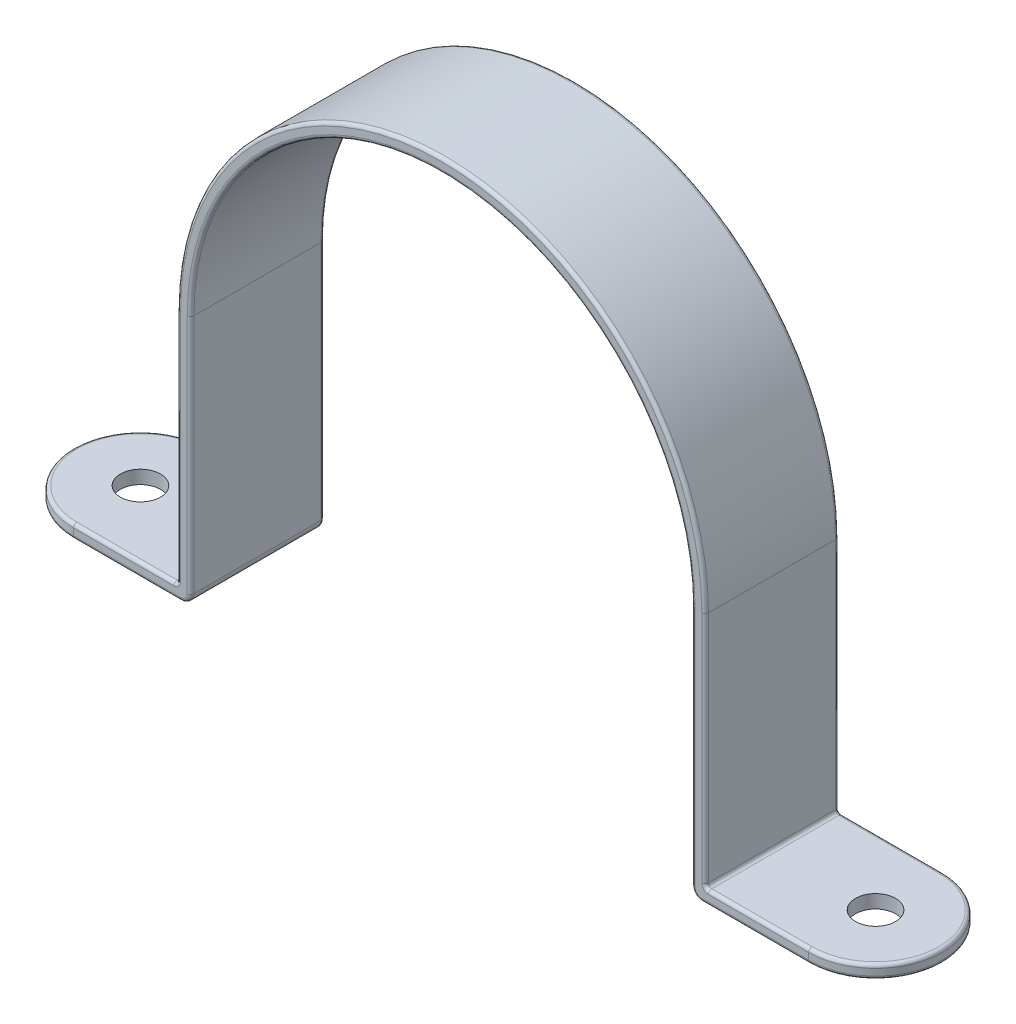
from build123d import *

# Parameters (mm, degrees)
BOSS_EXTRUDE1_DEPTH     = 10
CUT_EXTRUDE1_DEPTH      = 100.749686716
CUT_EXTRUDE1_DEPTH_BACK = 100.749686716
SKETCH3_R               = 3
FILLET2_R               = 1.5
FILLET3_R               = 0.5


with BuildPart() as part:
    # Sketch1 → Boss-Extrude1 (new, symmetric)
    with BuildSketch(Plane.XY):
        with BuildLine():
            Line((-39.5, 0), (-39.5, -35.5))
            Line((-39.5, -35.5), (-65, -35.5))
            Line((-65, -35.5), (-65, -37.5))
            Line((-65, -37.5), (-37.5, -37.5))
            Line((-37.5, -37.5), (-37.5, 0))
            ThreePointArc((-37.5, 0), (0, 37.5), (37.5, 0))
            Line((37.5, 0), (37.5, -37.5))
            Line((37.5, -37.5), (65, -37.5))
            Line((65, -37.5), (65, -35.5))
            Line((65, -35.5), (39.5, -35.5))
            Line((39.5, -35.5), (39.5, 0))
            ThreePointArc((39.5, 0), (0, 39.5), (-39.5, 0))
        make_face()
    extrude(amount=BOSS_EXTRUDE1_DEPTH, both=True)

    # Sketch3 → Cut-Extrude1 (cut, two sides: drawn at the far end of the back side and taken through both)
    with BuildSketch(Plane(origin=(0, -35.5, 0), x_dir=(1, 0, 0), z_dir=(0, 1, 0)).offset(-CUT_EXTRUDE1_DEPTH_BACK)):
        with BuildLine():
            Line((65, -10), (65, -1.23e-07))
            ThreePointArc((65, -1.23e-07), (62.071067768, -7.071067855), (55, -10))
            Line((55, -10), (65, -10))
        make_face()
        with BuildLine():
            Line((65, 10), (55, 10))
            ThreePointArc((55, 10), (62.071067855, 7.071067768), (65, -1.23e-07))
            Line((65, -1.23e-07), (65, 10))
        make_face()
        with BuildLine():
            Line((-65, 10), (-65, -7e-08))
            ThreePointArc((-65, -7e-08), (-62.071067837, 7.071067787), (-55, 10))
            Line((-55, 10), (-65, 10))
        make_face()
        with BuildLine():
            Line((-65, -10), (-55, -10))
            ThreePointArc((-55, -10), (-62.071067787, -7.071067837), (-65, -7e-08))
            Line((-65, -7e-08), (-65, -10))
        make_face()
        with Locations(Location((-55, 0, 0), (0, 0, 270))):
            Circle(SKETCH3_R)
        with Locations(Location((55, 0, 0), (0, 0, 270))):
            Circle(SKETCH3_R)
    extrude(amount=CUT_EXTRUDE1_DEPTH + CUT_EXTRUDE1_DEPTH_BACK, mode=Mode.SUBTRACT)

    # Fillet2
    fillet2_edges = [part.edges().sort_by_distance(p)[0] for p in [
        (37.5, -37.5, 0),
        (-37.5, -37.5, 0),
    ]]
    fillet(fillet2_edges, radius=FILLET2_R)

    # Fillet3
    fillet3_edges = [part.edges().sort_by_distance(p)[0] for p in [
        (0, 39.5, 10),
        (37.5, -18, -10),
        (0, 37.5, -10),
        (-47.25, -35.5, -10),
        (-39.5, -17.75, -10),
        (0, 39.5, -10),
        (39.5, -17.75, -10),
        (-39.5, -17.75, 10),
        (-47.25, -35.5, 10),
        (-39.5, -35.5, 0),
        (39.5, -35.5, 0),
        (47.25, -35.5, -10),
        (0, 37.5, 10),
        (-47, -37.5, 10),
        (37.5, -18, 10),
        (65, -37.5, 0),
        (65, -35.5, 0),
        (-65, -35.5, 0),
        (-65, -37.5, 0),
        (-47, -37.5, -10),
        (47.25, -35.5, 10),
        (47, -37.5, 10),
        (47, -37.5, -10),
        (39.5, -17.75, 10),
        (-37.5, -18, -10),
        (-37.939339828, -37.060660172, -10),
        (37.939339828, -37.060660172, -10),
        (-37.5, -18, 10),
        (-37.939339828, -37.060660172, 10),
        (37.939339828, -37.060660172, 10),
    ]]
    fillet(fillet3_edges, radius=FILLET3_R)


solid = part.part
